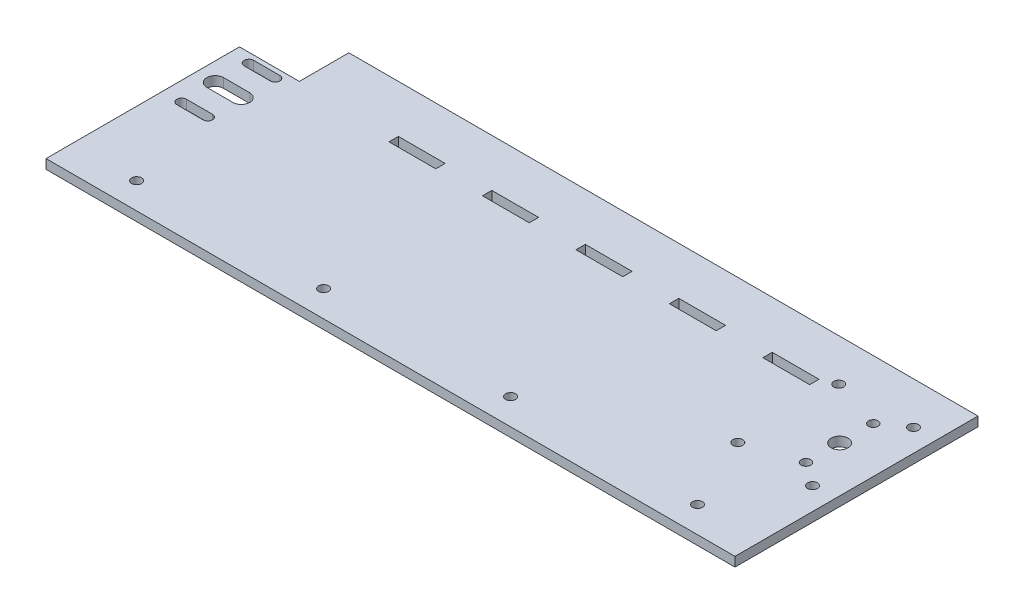
from build123d import *

# Parameters (mm, degrees)
SKETCH1_R           = 2.65
SKETCH1_R_2         = 2.55
SKETCH1_R_3         = 4.5
SKETCH1_W           = 25
SKETCH1_H           = 5
BOSS_EXTRUDE1_DEPTH = 5


with BuildPart() as part:
    # Sketch1 → Boss-Extrude1 (new body)
    with BuildSketch(Plane(origin=(0, 0, 0), x_dir=(1, 0, 0), z_dir=(0, 1, 0))):
        Polygon((0, 0), (0, 40), (0, 65), (-336.537, 65), (-336.537, 38.5), (-368.537, 38.5), (-368.537, -65), (0, -65), align=None)
        with Locations(Location((-12, 42.5, 0), (0, 0, 270))):
            Circle(SKETCH1_R, mode=Mode.SUBTRACT)
        with Locations(Location((-24.537, 33.50840474, 0), (0, 0, 270))):
            Circle(SKETCH1_R_2, mode=Mode.SUBTRACT)
        with Locations(Location((-24.537, -2.49159526, 0), (0, 0, 270))):
            Circle(SKETCH1_R_2, mode=Mode.SUBTRACT)
        with Locations(Location((-24.537, 15.50840474, 0), (0, 0, 270))):
            Circle(SKETCH1_R_3, mode=Mode.SUBTRACT)
        with Locations(Location((-12, -11.5, 0), (0, 0, 270))):
            Circle(SKETCH1_R, mode=Mode.SUBTRACT)
        with Locations(Location((-334.037, -51, 0), (0, 0, 270))):
            Circle(SKETCH1_R, mode=Mode.SUBTRACT)
        with Locations(Location((-234.037, -51, 0), (0, 0, 270))):
            Circle(SKETCH1_R, mode=Mode.SUBTRACT)
        with Locations(Location((-134.037, -51, 0), (0, 0, 270))):
            Circle(SKETCH1_R, mode=Mode.SUBTRACT)
        with Locations(Location((-34.037, -51, 0), (0, 0, 270))):
            Circle(SKETCH1_R, mode=Mode.SUBTRACT)
        with Locations(Location((-52, -11.5, 0), (0, 0, 270))):
            Circle(SKETCH1_R, mode=Mode.SUBTRACT)
        with Locations(Location((-52, 42.5, 0), (0, 0, 270))):
            Circle(SKETCH1_R, mode=Mode.SUBTRACT)
        with BuildLine():
            Line((-358.537, 20), (-344.537, 20))
            ThreePointArc((-344.537, 20), (-340.037, 15.5), (-344.537, 11))
            Line((-344.537, 11), (-358.537, 11))
            ThreePointArc((-358.537, 11), (-363.037, 15.5), (-358.537, 20))
        make_face(mode=Mode.SUBTRACT)
        with BuildLine():
            Line((-344.5, 0.05), (-358.5, 0.05))
            ThreePointArc((-358.5, 0.05), (-361.05, -2.5), (-358.5, -5.05))
            Line((-358.5, -5.05), (-344.5, -5.05))
            ThreePointArc((-344.5, -5.05), (-341.95, -2.5), (-344.5, 0.05))
        make_face(mode=Mode.SUBTRACT)
        with Locations((-122.055571099, 37)):
            Rectangle(SKETCH1_W, SKETCH1_H, mode=Mode.SUBTRACT)
        with BuildLine():
            Line((-358.5, 36.05), (-344.5, 36.05))
            ThreePointArc((-344.5, 36.05), (-341.95, 33.5), (-344.5, 30.95))
            Line((-344.5, 30.95), (-358.5, 30.95))
            ThreePointArc((-358.5, 30.95), (-361.05, 33.5), (-358.5, 36.05))
        make_face(mode=Mode.SUBTRACT)
        with Locations((-72.055571099, 37)):
            Rectangle(SKETCH1_W, SKETCH1_H, mode=Mode.SUBTRACT)
        with Locations((-272.055571099, 37)):
            Rectangle(SKETCH1_W, SKETCH1_H, mode=Mode.SUBTRACT)
        with Locations((-222.055571099, 37)):
            Rectangle(SKETCH1_W, SKETCH1_H, mode=Mode.SUBTRACT)
        with Locations((-172.055571099, 37)):
            Rectangle(SKETCH1_W, SKETCH1_H, mode=Mode.SUBTRACT)
    extrude(amount=BOSS_EXTRUDE1_DEPTH)


solid = part.part
